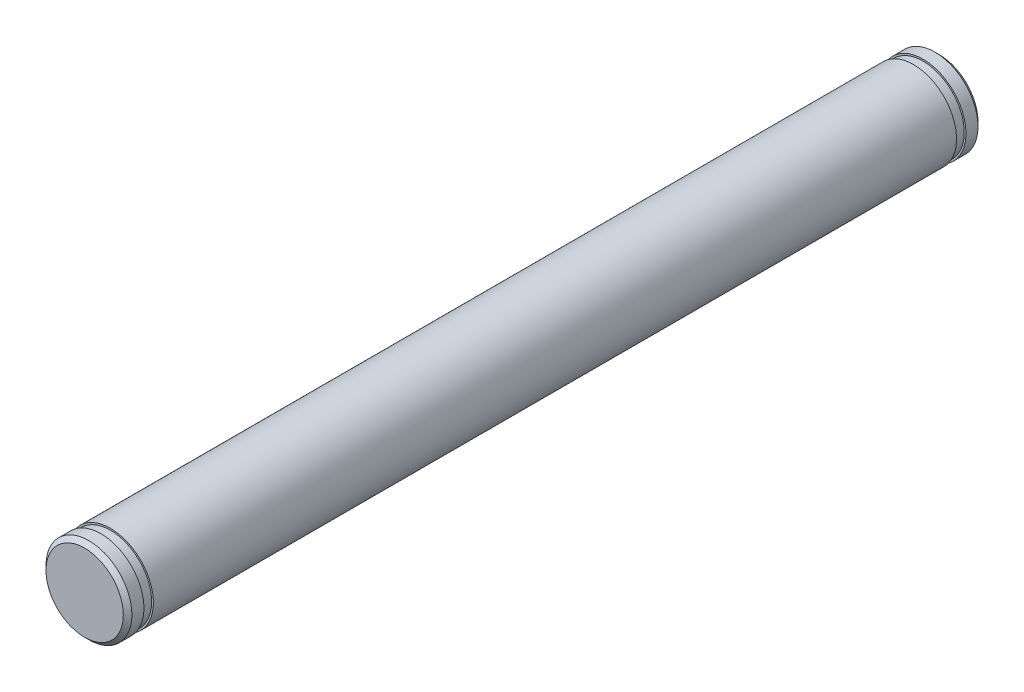
from build123d import *

# Parameters (mm, degrees)
SKETCH_1_R          = 5
EXTRUDE_1_DEPTH     = 99.5
CHAMFER_1_SIZE      = 0.5
CUT_EXTRUDE_START   = -1.9
SKETCH_2_R          = 5
SKETCH_2_R_2        = 4.8
CUT_EXTRUDE_1_DEPTH = 1.1


with BuildPart() as part:
    # 草图1 → 凸台-拉伸1 (new body)
    with BuildSketch(Plane.XY):
        Circle(SKETCH_1_R)
    extrude(amount=EXTRUDE_1_DEPTH)

    # 倒角1
    chamfer_1_edges = [part.edges().sort_by_distance(p)[0] for p in [
        (-5, 0, 0),
        (-5, 0, 99.5),
    ]]
    chamfer(chamfer_1_edges, length=CHAMFER_1_SIZE)

    # 草图2 → 切除-拉伸1 (cut)
    with BuildSketch(Plane(origin=(0, 0, 0), x_dir=(-1, 0, 0), z_dir=(0, 0, -1)).offset(CUT_EXTRUDE_START)):
        Circle(SKETCH_2_R)
        Circle(SKETCH_2_R_2, mode=Mode.SUBTRACT)
    cut_extrude_1 = extrude(amount=-CUT_EXTRUDE_1_DEPTH, mode=Mode.SUBTRACT)

    # 镜向1: 切除-拉伸1 across plane
    add(cut_extrude_1.mirror(Plane.XY.offset(49.75)), mode=Mode.SUBTRACT)


solid = part.part
